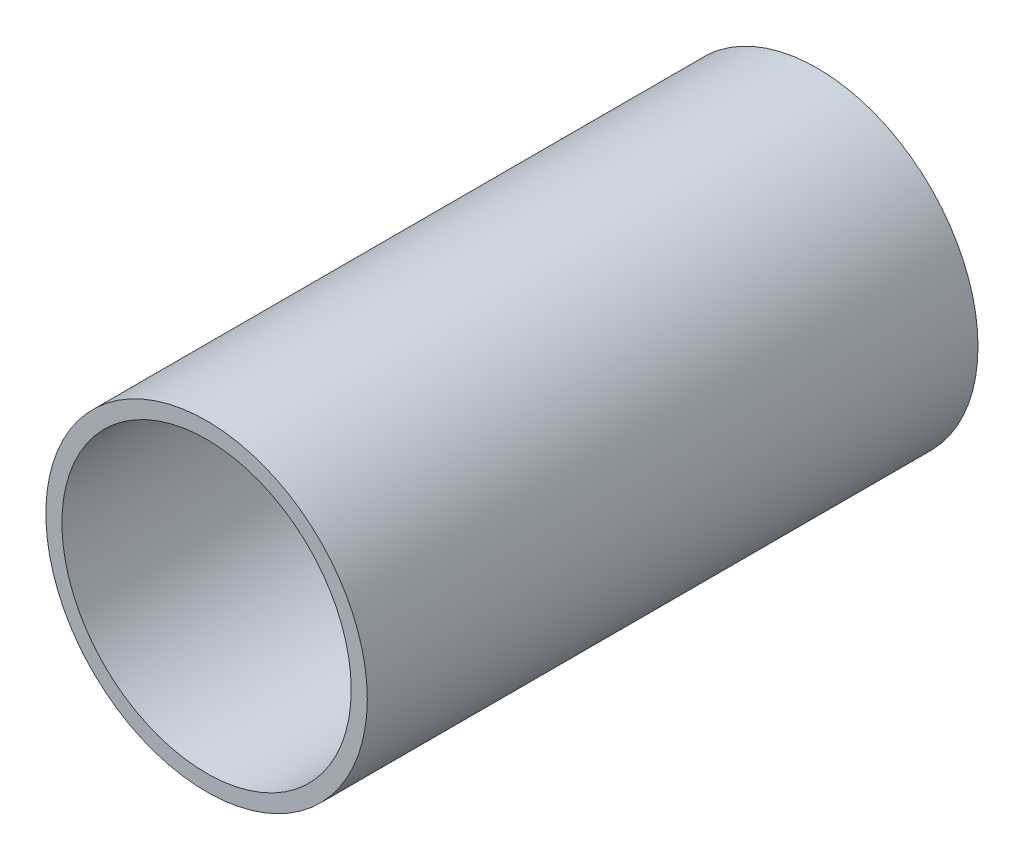
from build123d import *

# Parameters (mm, degrees)
SKETCH_1_R      = 10
SKETCH_1_R_2    = 9
EXTRUDE_1_DEPTH = 38


with BuildPart() as part:
    # 草图1 → 凸台-拉伸1 (new body)
    with BuildSketch(Plane.XY):
        with Locations((-1.569352558, 0)):
            Circle(SKETCH_1_R)
        with Locations((-1.569352558, 0)):
            Circle(SKETCH_1_R_2, mode=Mode.SUBTRACT)
    extrude(amount=EXTRUDE_1_DEPTH)


solid = part.part
